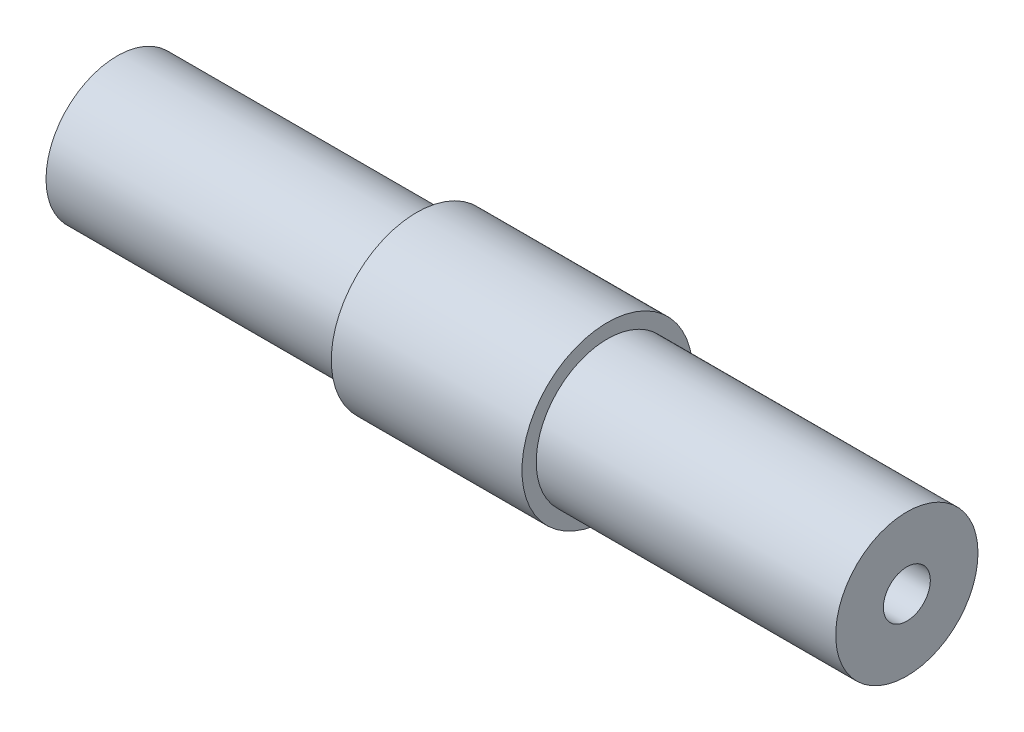
from build123d import *

# Parameters (mm, degrees)
SKETCH_1_R          = 6
EXTRUDE_1_DEPTH     = 13.4
SKETCH_2_R          = 5
EXTRUDE_2_DEPTH     = 21.05
EXTRUDE_START       = 21.05
SKETCH_3_R          = 5
EXTRUDE_3_DEPTH     = 21.05
SKETCH_4_R          = 1.65
CUT_EXTRUDE_1_DEPTH = 10
CUT_EXTRUDE_START   = -10
SKETCH_5_R          = 1.65
CUT_EXTRUDE_2_DEPTH = 10


with BuildPart() as part:
    # ｽｹｯﾁ1 → ﾎﾞｽ - 押し出し1 (new body)
    with BuildSketch(Plane(origin=(0, 0, 0), x_dir=(0, 0, -1), z_dir=(1, 0, 0))):
        Circle(SKETCH_1_R)
    extrude(amount=EXTRUDE_1_DEPTH)

    # ｽｹｯﾁ2 → ﾎﾞｽ - 押し出し2 (add)
    with BuildSketch(Plane(origin=(13.4, 0, 0), x_dir=(0, 0, -1), z_dir=(1, 0, 0))):
        Circle(SKETCH_2_R)
    extrude(amount=EXTRUDE_2_DEPTH)

    # ｽｹｯﾁ3 → ﾎﾞｽ - 押し出し3 (add)
    with BuildSketch(Plane.ZY.offset(EXTRUDE_START)):
        with Locations(Location((0, 0, 0), (0, 0, 180))):
            Circle(SKETCH_3_R)
    extrude(amount=-EXTRUDE_3_DEPTH)

    # ｽｹｯﾁ4 → ｶｯﾄ - 押し出し1 (cut)
    with BuildSketch(Plane(origin=(34.45, 0, 0), x_dir=(0, 0, -1), z_dir=(1, 0, 0))):
        Circle(SKETCH_4_R)
    extrude(amount=-CUT_EXTRUDE_1_DEPTH, mode=Mode.SUBTRACT)

    # ｽｹｯﾁ5 → ｶｯﾄ - 押し出し2 (cut)
    with BuildSketch(Plane.ZY.offset(21.05).offset(CUT_EXTRUDE_START)):
        with Locations(Location((0, 0, 0), (0, 0, 180))):
            Circle(SKETCH_5_R)
    extrude(amount=CUT_EXTRUDE_2_DEPTH, mode=Mode.SUBTRACT)


solid = part.part
